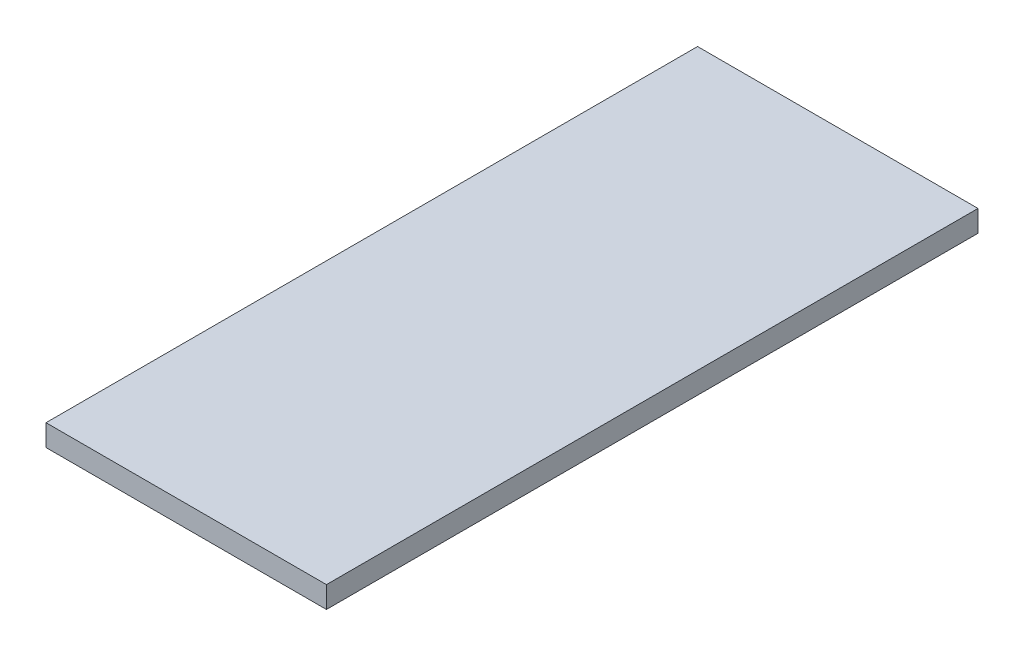
from build123d import *

# Parameters (mm, degrees)
SKETCH1_W           = 260.4
SKETCH1_H           = 605
BOSS_EXTRUDE1_DEPTH = 20


with BuildPart() as part:
    # Sketch1 → Boss-Extrude1 (new body)
    with BuildSketch(Plane(origin=(0, 0, 0), x_dir=(1, 0, 0), z_dir=(0, 1, 0))):
        with Locations((130.2, 302.5)):
            Rectangle(SKETCH1_W, SKETCH1_H)
    extrude(amount=BOSS_EXTRUDE1_DEPTH)


solid = part.part
